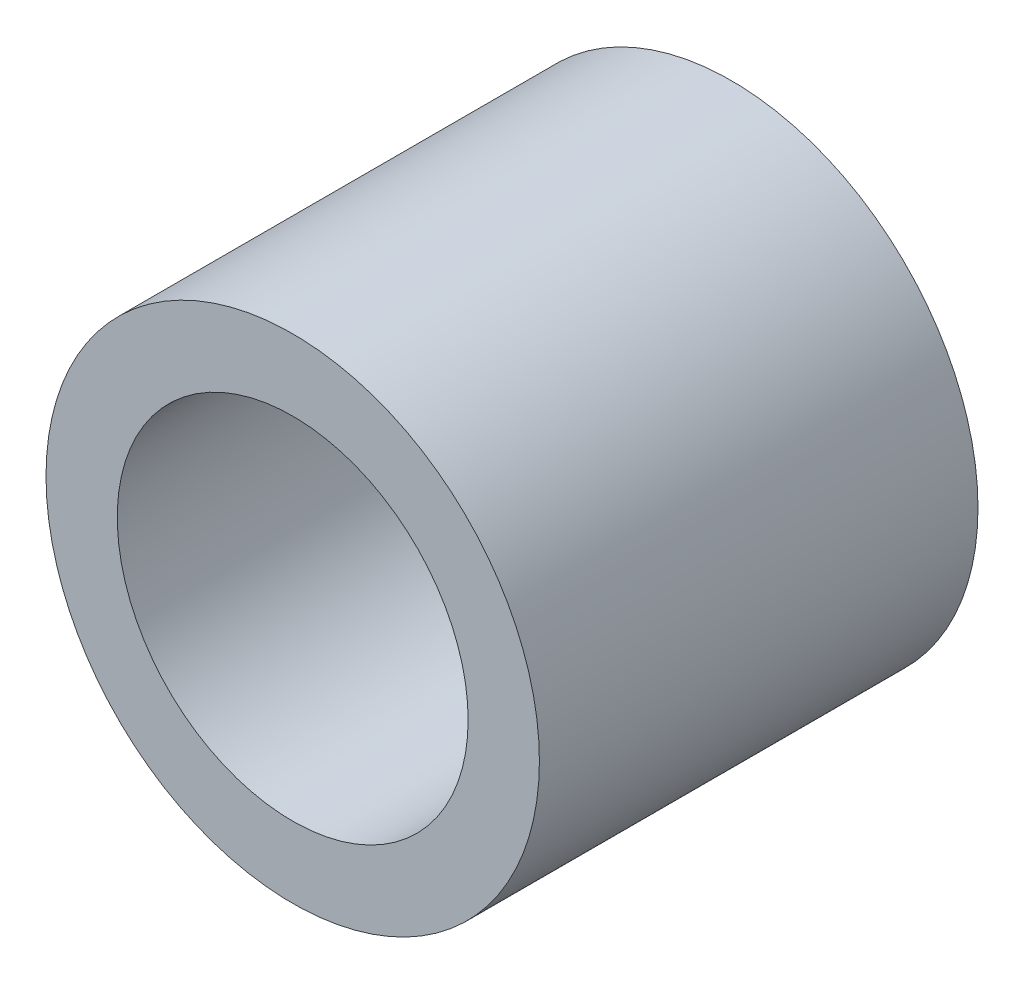
from build123d import *

# Parameters (mm, degrees)
SKETCH1_R           = 2.25
SKETCH1_R_2         = 1.6
BOSS_EXTRUDE1_DEPTH = 4


with BuildPart() as part:
    # Sketch1 → Boss-Extrude1 (new body)
    with BuildSketch(Plane.XY):
        Circle(SKETCH1_R)
        Circle(SKETCH1_R_2, mode=Mode.SUBTRACT)
    extrude(amount=BOSS_EXTRUDE1_DEPTH)


solid = part.part
